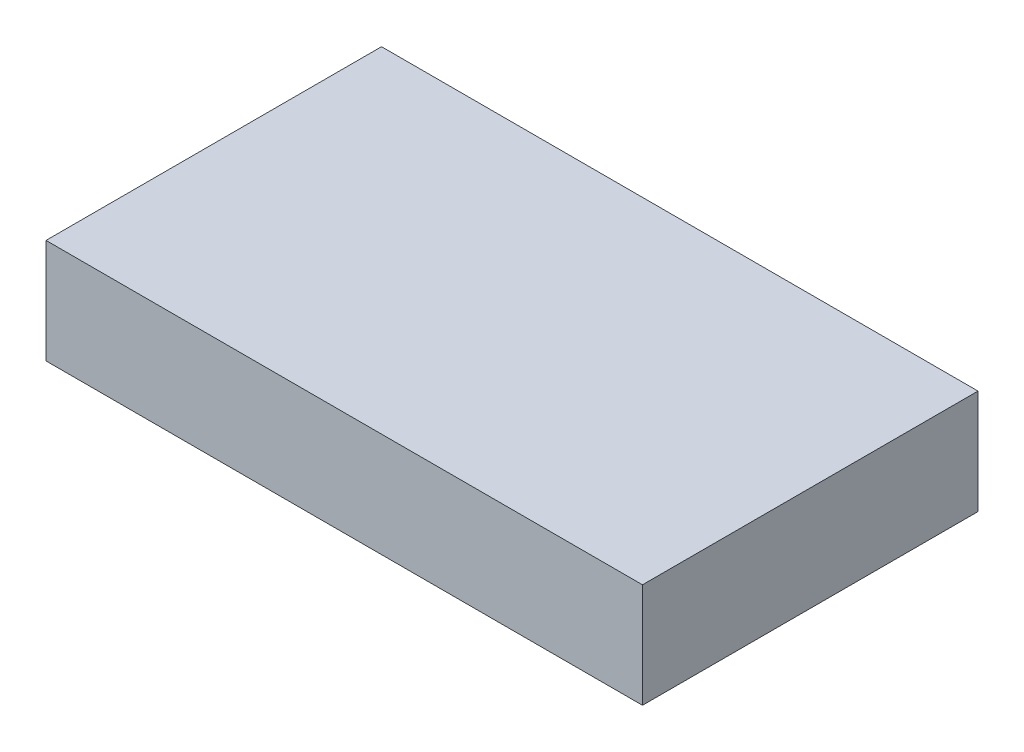
from build123d import *

# Parameters (mm, degrees)
SKETCH1_W           = 8
SKETCH1_H           = 1.4
BOSS_EXTRUDE1_DEPTH = 4.5


with BuildPart() as part:
    # Sketch1 → Boss-Extrude1 (new body)
    with BuildSketch(Plane.XY):
        with Locations((4, 0.7)):
            Rectangle(SKETCH1_W, SKETCH1_H)
    extrude(amount=BOSS_EXTRUDE1_DEPTH)


solid = part.part
